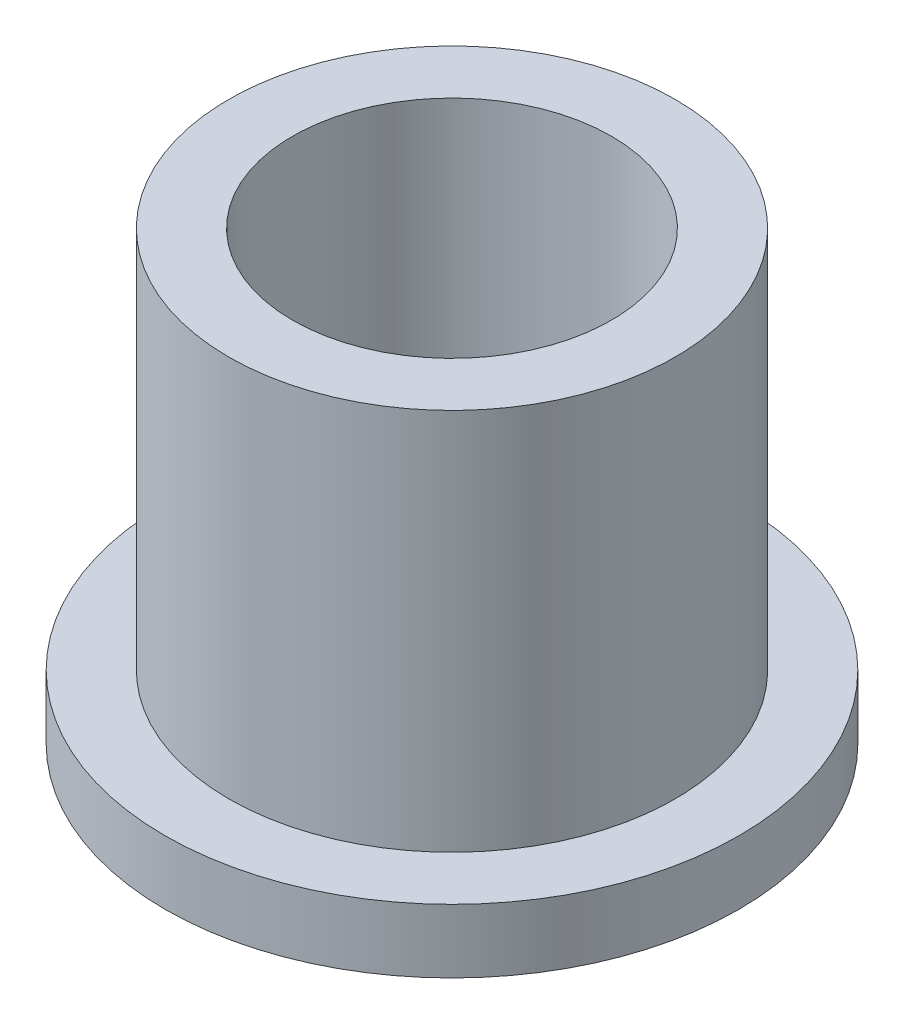
from build123d import *

# Parameters (mm, degrees)
SKETCH2_R           = 5.55625
SKETCH2_R_2         = 3.96875
BOSS_EXTRUDE1_DEPTH = 11.1125
SKETCH3_R           = 7.14375
SKETCH3_R_2         = 5.55625
BOSS_EXTRUDE2_DEPTH = 1.5875


with BuildPart() as part:
    # Sketch2 → Boss-Extrude1 (new body)
    with BuildSketch(Plane(origin=(0, 0, 0), x_dir=(1, 0, 0), z_dir=(0, 1, 0))):
        with Locations(Location((0, 0, 0), (0, 0, 270))):
            Circle(SKETCH2_R)
        with Locations(Location((0, 0, 0), (0, 0, 270))):
            Circle(SKETCH2_R_2, mode=Mode.SUBTRACT)
    extrude(amount=BOSS_EXTRUDE1_DEPTH)

    # Sketch3 → Boss-Extrude2 (add)
    with BuildSketch(Plane(origin=(0, 0, 0), x_dir=(1, 0, 0), z_dir=(0, 1, 0))):
        with Locations(Location((0, 0, 0), (0, 0, 270))):
            Circle(SKETCH3_R)
        with Locations(Location((0, 0, 0), (0, 0, 270))):
            Circle(SKETCH3_R_2, mode=Mode.SUBTRACT)
    extrude(amount=BOSS_EXTRUDE2_DEPTH)


solid = part.part
